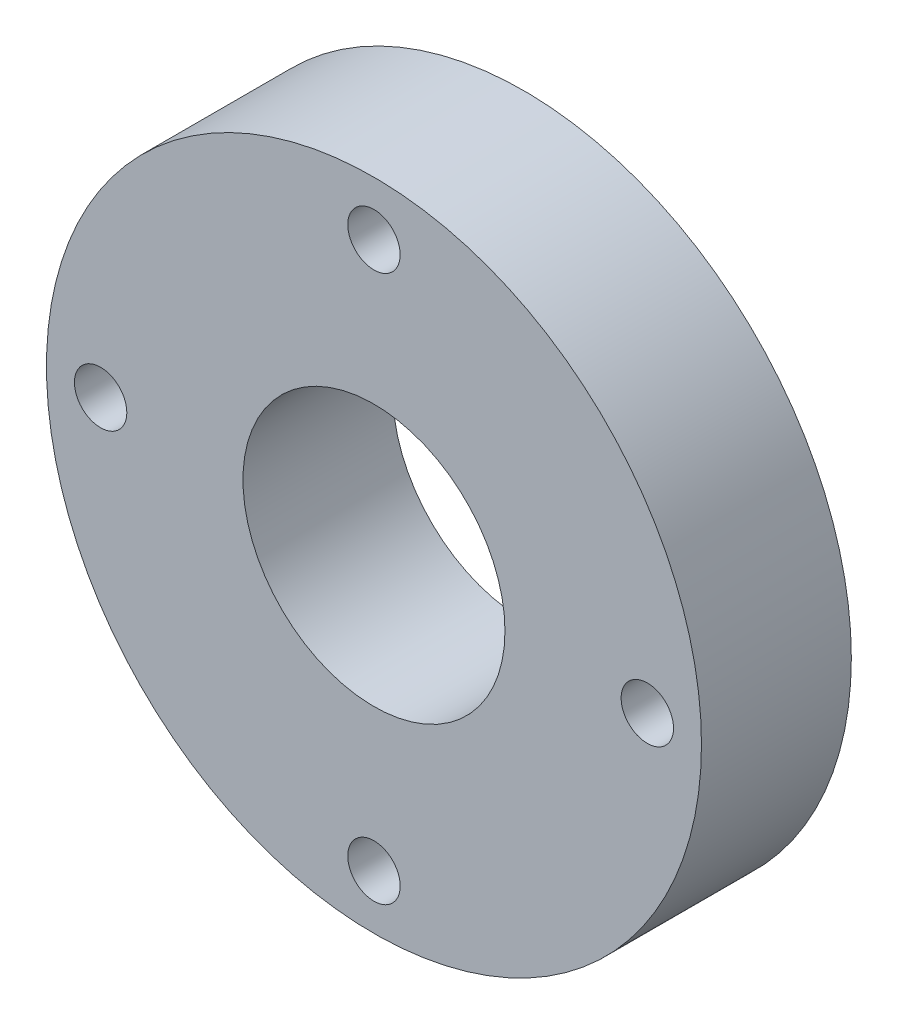
from build123d import *

# Parameters (mm, degrees)
SKETCH1_R           = 125
SKETCH1_R_2         = 50
BOSS_EXTRUDE1_DEPTH = 57.2
SKETCH2_R           = 10
CUT_EXTRUDE1_DEPTH  = 57.2


with BuildPart() as part:
    # Sketch1 → Boss-Extrude1 (new body)
    with BuildSketch(Plane.XY):
        Circle(SKETCH1_R)
        Circle(SKETCH1_R_2, mode=Mode.SUBTRACT)
    extrude(amount=BOSS_EXTRUDE1_DEPTH)

    # Sketch2 → Cut-Extrude1 (cut)
    with BuildSketch(Plane.XY.offset(57.2)):
        with Locations((-104.3291977, 0)):
            Circle(SKETCH2_R)
        with Locations((0, 104.3291977)):
            Circle(SKETCH2_R)
        with Locations((104.3291977, 0)):
            Circle(SKETCH2_R)
        with Locations((0, -104.3291977)):
            Circle(SKETCH2_R)
    extrude(amount=-CUT_EXTRUDE1_DEPTH, mode=Mode.SUBTRACT)


solid = part.part
